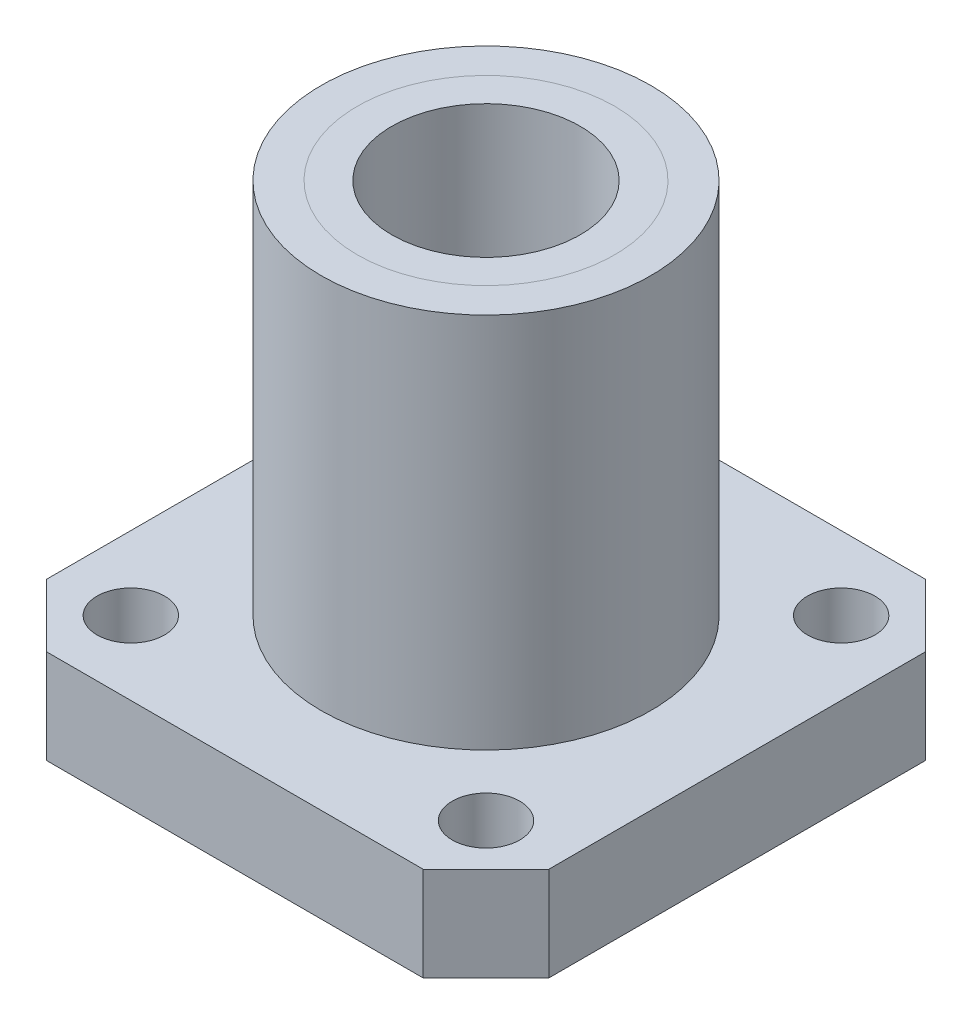
from build123d import *

# Parameters (mm, degrees)
SKETCH1_R           = 10.5
SKETCH1_R_2         = 6
BOSS_EXTRUDE1_DEPTH = 30
SKETCH2_W           = 32
SKETCH2_H           = 32
SKETCH2_R           = 6
BOSS_EXTRUDE2_DEPTH = 6
SKETCH3_R           = 2.15
CUT_EXTRUDE1_DEPTH  = 38.576588456
CHAMFER1_SIZE       = 4


with BuildPart() as part:
    # Sketch1 → Boss-Extrude1 (new body)
    with BuildSketch(Plane(origin=(0, 0, 0), x_dir=(1, 0, 0), z_dir=(0, 1, 0))):
        with Locations(Location((0, 0, 0), (0, 0, 270))):
            Circle(SKETCH1_R)
        with Locations(Location((0, 0, 0), (0, 0, 270))):
            Circle(SKETCH1_R_2, mode=Mode.SUBTRACT)
    extrude(amount=BOSS_EXTRUDE1_DEPTH)

    # Sketch2 → Boss-Extrude2 (add)
    with BuildSketch(Plane(origin=(0, 0, 0), x_dir=(1, 0, 0), z_dir=(0, 1, 0))):
        Rectangle(SKETCH2_W, SKETCH2_H)
        with Locations(Location((0, 0, 0), (0, 0, 270))):
            Circle(SKETCH2_R, mode=Mode.SUBTRACT)
    extrude(amount=BOSS_EXTRUDE2_DEPTH)

    # Sketch3 → Cut-Extrude1 (cut, through all)
    with BuildSketch(Plane(origin=(0, 0, 0), x_dir=(1, 0, 0), z_dir=(0, 1, 0))):
        with Locations(Location((-11.313708499, 11.313708499, 0), (0, 0, 270))):
            Circle(SKETCH3_R)
        with Locations(Location((-11.313708499, -11.313708499, 0), (0, 0, 270))):
            Circle(SKETCH3_R)
        with Locations(Location((11.313708499, -11.313708499, 0), (0, 0, 270))):
            Circle(SKETCH3_R)
        with Locations(Location((11.313708499, 11.313708499, 0), (0, 0, 270))):
            Circle(SKETCH3_R)
    extrude(amount=CUT_EXTRUDE1_DEPTH, mode=Mode.SUBTRACT)

    # Chamfer1
    chamfer1_edges = [part.edges().sort_by_distance(p)[0] for p in [
        (16, 3, 16),
        (16, 3, -16),
        (-16, 3, -16),
        (-16, 3, 16),
    ]]
    chamfer(chamfer1_edges, length=CHAMFER1_SIZE)


solid = part.part
